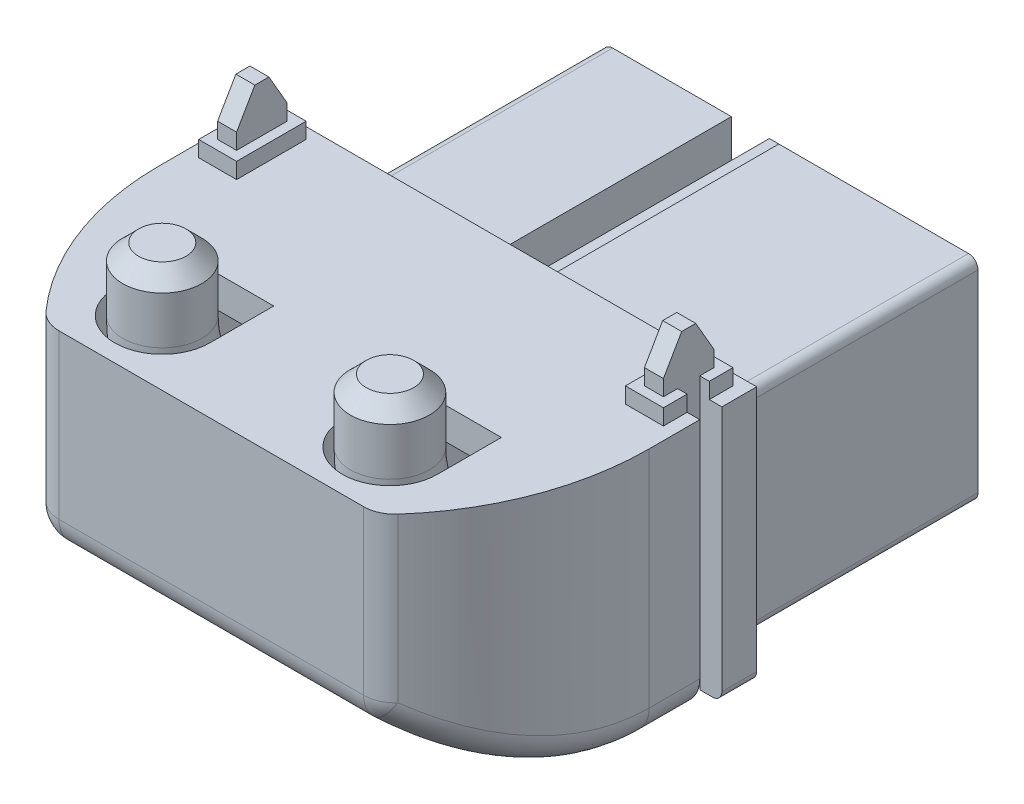
from build123d import *
from OCP.BRepFilletAPI import BRepFilletAPI_MakeChamfer

# Parameters (mm, degrees)
EXTRUDE_1_DEPTH                  = 11.1
CUT_EXTRUDE_1_DEPTH              = 7.7
SKETCH_13_R                      = 2.175
CUT_EXTRUDE_9_DEPTH              = 7.7
CUT_EXTRUDE_10_REACH             = 14.986
SKETCH_3_W                       = 1.5
SKETCH_3_H                       = 1.2
CUT_EXTRUDE_10_DIRECTION_2_REACH = 14.986
SKETCH_14_W                      = 1.5
SKETCH_14_H                      = 4
EXTRUDE_5_DEPTH                  = 1.2
EXTRUDE_START                    = 6.5
SKETCH_5_R                       = 2.175
EXTRUDE_3_DEPTH                  = 6.5
SKETCH_10_R                      = 2.15
CUT_EXTRUDE_7_DEPTH              = 6.5
SKETCH_16_R                      = 1.25
SKETCH_18_R                      = 1.25
EXTRUDE_7_DEPTH                  = 2
EXTRUDE_8_DEPTH                  = 8.1
EXTRUDE_START_2                  = -2.1
EXTRUDE_9_DEPTH                  = 2.1
SKETCH_21_W                      = 10.2
SKETCH_21_H                      = 2.025
EXTRUDE_12_DEPTH                 = 1
SKETCH_22_W                      = 0.6
SKETCH_22_H                      = 1.6
CUT_EXTRUDE_12_DEPTH             = 21.530769591
SKETCH_23_W                      = 0.7
SKETCH_23_H                      = 0.7
CUT_EXTRUDE_13_DEPTH             = 21.530769591
EXTRUDE_13_DEPTH                 = 2
EXTRUDE_13_DEPTH_BACK            = 7.6
SKETCH_24_W                      = 0.6
SKETCH_24_H                      = 1.6
EXTRUDE_14_DEPTH                 = 0.5
CHAMFER_2_SIZE                   = 1
CHAMFER_2_SIZE2                  = 0.577350269
CHAMFER_3_SIZE                   = 0.5
SKETCH_26_W                      = 9.9
SKETCH_26_H                      = 1.6
CUT_EXTRUDE_14_DEPTH             = 0.7
FILLET_4_R                       = 0.3
CUT_EXTRUDE_15_DEPTH             = 20.811738944
CUT_EXTRUDE_15_DEPTH_BACK        = 20.811738944
FILLET_5_R                       = 1


with BuildPart() as part:
    # Эскиз1 → Бобышка-Вытянуть1 (new body)
    with BuildSketch(Plane.XY):
        Polygon((-7.75, 1.221572875), (-7.75, -1.221572875), (-4.921572875, -4.05), (7.75, -4.05), (7.75, 4.05), (-4.921572875, 4.05), align=None)
    extrude(amount=EXTRUDE_1_DEPTH)

    # Эскиз2 → Вырез-Вытянуть1 (cut)
    with BuildSketch(Plane(origin=(0, 0, 0), x_dir=(-1, 0, 0), z_dir=(0, 0, -1))):
        Polygon((-7.75, 4.05), (-7.75, -4.05), (4.921572875, -4.05), (7.75, -1.221572875), (7.75, 1.221572875), (4.921572875, 4.05), align=None)
        Polygon((4.631623382, 3.35), (7.05, 0.931623382), (7.05, -0.931623382), (4.631623382, -3.35), (-7.05, -3.35), (-7.05, 3.35), align=None, mode=Mode.SUBTRACT)
    extrude(amount=-CUT_EXTRUDE_1_DEPTH, mode=Mode.SUBTRACT)

    # Эскиз13 → Вырез-Вытянуть9 (cut)
    with BuildSketch(Plane(origin=(0, 0, 0), x_dir=(-1, 0, 0), z_dir=(0, 0, -1))):
        with Locations((-3.6, 0)):
            Circle(SKETCH_13_R)
        with Locations((3.6, 0)):
            Circle(SKETCH_13_R)
    extrude(amount=-CUT_EXTRUDE_9_DEPTH, mode=Mode.SUBTRACT)

    # Вырез-Вытянуть10: up to this face of the body (flat: up to its plane)
    cut_extrude_10_end = Plane(part.part.faces().sort_by_distance((-3.6, 0, 7.7))[0])
    # Эскиз3 → Вырез-Вытянуть10 (cut, up to the picked face)
    with BuildSketch(Plane(origin=(0, 0, 1.5), x_dir=(-1, 0, 0), z_dir=(0, 0, -1)), mode=Mode.PRIVATE) as cut_extrude_10_sk1:
        with Locations((0, 2.75)):
            Rectangle(SKETCH_3_W, SKETCH_3_H)
    cut_extrude_10_tool1 = split(extrude(cut_extrude_10_sk1.sketch, amount=-CUT_EXTRUDE_10_REACH, mode=Mode.PRIVATE), bisect_by=cut_extrude_10_end, keep=Keep.BOTH, mode=Mode.PRIVATE)
    add(cut_extrude_10_tool1.solids().sort_by(Axis((0, 2.75, 1.5), (0, 0, 1)))[0], mode=Mode.SUBTRACT)

    # Вырез-Вытянуть10 direction 2: up to this face of the body (flat: up to its plane)
    cut_extrude_10_direction_2_end = Plane(part.part.faces().sort_by_distance((0.620013342, 0, 0))[0])
    # Эскиз3 → Вырез-Вытянуть10 direction 2 (cut, up to the picked face)
    with BuildSketch(Plane(origin=(0, 0, 1.5), x_dir=(-1, 0, 0), z_dir=(0, 0, -1)), mode=Mode.PRIVATE) as cut_extrude_10_direction_2_sk1:
        with Locations((0, 2.75)):
            Rectangle(SKETCH_3_W, SKETCH_3_H)
    cut_extrude_10_direction_2_tool1 = split(extrude(cut_extrude_10_direction_2_sk1.sketch, amount=CUT_EXTRUDE_10_DIRECTION_2_REACH, mode=Mode.PRIVATE), bisect_by=cut_extrude_10_direction_2_end, keep=Keep.BOTH, mode=Mode.PRIVATE)
    add(cut_extrude_10_direction_2_tool1.solids().sort_by(Axis((0, 2.75, 1.5), (0, 0, -1)))[0], mode=Mode.SUBTRACT)

    # Эскиз14 → Бобышка-Вытянуть5 (add)
    with BuildSketch(Plane(origin=(0, 0, 0), x_dir=(-1, 0, 0), z_dir=(0, 0, -1))):
        with Locations((0, 0.15)):
            Rectangle(SKETCH_14_W, SKETCH_14_H)
    extrude(amount=EXTRUDE_5_DEPTH)

    # Эскиз5 → Бобышка-Вытянуть3 (add)
    with BuildSketch(Plane(origin=(0, 0, 7.7), x_dir=(-1, 0, 0), z_dir=(0, 0, -1)).offset(EXTRUDE_START)):
        with Locations((3.6, 0)):
            Circle(SKETCH_5_R)
        with Locations((-3.6, 0)):
            Circle(SKETCH_5_R)
    extrude(amount=-EXTRUDE_3_DEPTH)

    # Эскиз10 → Вырез-Вытянуть7 (cut)
    with BuildSketch(Plane(origin=(0, 0, 1.2), x_dir=(-1, 0, 0), z_dir=(0, 0, -1))):
        with Locations((-3.6, 0)):
            Circle(SKETCH_10_R)
        with Locations((3.6, 0)):
            Circle(SKETCH_10_R)
    extrude(amount=-CUT_EXTRUDE_7_DEPTH, mode=Mode.SUBTRACT)

    # По траектории1: sweep along a path in Эскиз17
    with BuildLine(Plane(origin=(0, 0, 0), x_dir=(0, 0, -1), z_dir=(1, 0, 0))) as sweep_1_path:
        ThreePointArc((-15.15, 4.05), (-13.963782464, 1.186217536), (-11.1, 0))
    # Эскиз16 → По траектории1 (sweep)
    with BuildSketch(Plane.XY.offset(11.1)):
        with Locations((3.6, 0)):
            Circle(SKETCH_16_R)
        with Locations((-3.6, 0)):
            Circle(SKETCH_16_R)
    sweep(path=sweep_1_path.line)

    # Эскиз18 → Бобышка-Вытянуть7 (add)
    with BuildSketch(Plane(origin=(0, 4.05, 0), x_dir=(1, 0, 0), z_dir=(0, 1, 0))):
        with Locations(Location((3.6, -15.15, 0), (0, 0, 270))):
            Circle(SKETCH_18_R)
        with Locations(Location((-3.6, -15.15, 0), (0, 0, 270))):
            Circle(SKETCH_18_R)
    extrude(amount=EXTRUDE_7_DEPTH)

    # Эскиз19 → Бобышка-Вытянуть8 (add)
    with BuildSketch(Plane(origin=(0, 4.05, 0), x_dir=(1, 0, 0), z_dir=(0, 1, 0))):
        with BuildLine():
            ThreePointArc((5.25, -17.2), (7.100752265, -14.396209945), (7.75, -11.1))
            Line((7.75, -11.1), (5.1, -11.1))
            Line((5.1, -11.1), (5.1, -15.15))
            ThreePointArc((5.1, -15.15), (3.6, -16.65), (2.1, -15.15))
            Line((2.1, -15.15), (2.1, -11.1))
            Line((2.1, -11.1), (-2.1, -11.1))
            Line((-2.1, -11.1), (-2.1, -15.15))
            ThreePointArc((-2.1, -15.15), (-3.6, -16.65), (-5.1, -15.15))
            Line((-5.1, -15.15), (-5.1, -11.1))
            Line((-5.1, -11.1), (-4.921572875, -11.1))
            Line((-4.921572875, -11.1), (-4.921572875, -7.7))
            Line((-4.921572875, -7.7), (-7.75, -7.7))
            Line((-7.75, -7.7), (-7.75, -11.1))
            ThreePointArc((-7.75, -11.1), (-7.100752265, -14.396209945), (-5.25, -17.2))
            Line((-5.25, -17.2), (5.25, -17.2))
        make_face()
    extrude(amount=-EXTRUDE_8_DEPTH)

    # Эскиз20 → Бобышка-Вытянуть9 (add)
    with BuildSketch(Plane.XZ.offset(4.05).offset(EXTRUDE_START_2)):
        with BuildLine():
            Line((-7.75, 7.7), (7.75, 7.7))
            Line((7.75, 7.7), (7.75, 11.1))
            ThreePointArc((7.75, 11.1), (7.100752265, 14.396209945), (5.25, 17.2))
            Line((5.25, 17.2), (-5.25, 17.2))
            ThreePointArc((-5.25, 17.2), (-7.100752265, 14.396209945), (-7.75, 11.1))
            Line((-7.75, 11.1), (-7.75, 7.7))
        make_face()
    extrude(amount=EXTRUDE_9_DEPTH)

    # Эскиз21 → Бобышка-Вытянуть12 (add)
    with BuildSketch(Plane(origin=(0, 4.05, 0), x_dir=(1, 0, 0), z_dir=(0, 1, 0))):
        with Locations((0, -12.1125)):
            Rectangle(SKETCH_21_W, SKETCH_21_H)
    extrude(amount=-EXTRUDE_12_DEPTH)

    # Эскиз22 → Вырез-Вытянуть12 (cut, through all)
    with BuildSketch(Plane(origin=(0, 4.05, 0), x_dir=(1, 0, 0), z_dir=(0, 1, 0))):
        with Locations((-6.75, -9.15)):
            Rectangle(SKETCH_22_W, SKETCH_22_H)
        with Locations((6.75, -9.15)):
            Rectangle(SKETCH_22_W, SKETCH_22_H)
    extrude(amount=-CUT_EXTRUDE_12_DEPTH, mode=Mode.SUBTRACT)

    # Эскиз23 → Вырез-Вытянуть13 (cut, through all)
    with BuildSketch(Plane(origin=(0, 4.05, 0), x_dir=(1, 0, 0), z_dir=(0, 1, 0))):
        with Locations((-7.4, -9.15)):
            Rectangle(SKETCH_23_W, SKETCH_23_H)
        with Locations((7.4, -9.15)):
            Rectangle(SKETCH_23_W, SKETCH_23_H)
    extrude(amount=-CUT_EXTRUDE_13_DEPTH, mode=Mode.SUBTRACT)

    # Эскиз24 → Бобышка-Вытянуть13 (add, two sides: drawn at the far end of the back side and taken through both)
    with BuildSketch(Plane(origin=(0, 4.05, 0), x_dir=(1, 0, 0), z_dir=(0, 1, 0)).offset(-EXTRUDE_13_DEPTH_BACK)):
        with Locations((-6.75, -9.15)):
            Rectangle(SKETCH_24_W, SKETCH_24_H)
        with Locations((6.75, -9.15)):
            Rectangle(SKETCH_24_W, SKETCH_24_H)
    extrude(amount=EXTRUDE_13_DEPTH + EXTRUDE_13_DEPTH_BACK)

    # Эскиз25 → Бобышка-Вытянуть14 (add)
    with BuildSketch(Plane(origin=(0, 4.05, 0), x_dir=(1, 0, 0), z_dir=(0, 1, 0))):
        Polygon((-6.15, -8.05), (-7.35, -8.05), (-7.35, -8.8), (-7.05, -8.8), (-7.05, -8.35), (-6.45, -8.35), (-6.45, -9.95), (-7.05, -9.95), (-7.05, -9.5), (-7.35, -9.5), (-7.35, -10.25), (-6.15, -10.25), align=None)
        Polygon((7.35, -8.05), (6.15, -8.05), (6.15, -10.25), (7.35, -10.25), (7.35, -9.5), (7.05, -9.5), (7.05, -9.95), (6.45, -9.95), (6.45, -8.35), (7.05, -8.35), (7.05, -8.8), (7.35, -8.8), align=None)
    extrude(amount=EXTRUDE_14_DEPTH)

    # Фаска2: one chamfer whose edges measure the first distance from different faces: ONE call of the kernel's chamfer builder (chamfer() names one face for all edges)
    chamfer_2_edges_1 = [part.edges().sort_by_distance(p)[0] for p in [
        (-6.75, 6.05, 9.95),
    ]]
    chamfer_2_side_1 = [part.faces().sort_by_distance(p)[0] for p in [
        (-6.75, 5.3, 9.95),
    ]]
    chamfer_2_edges_2 = [part.edges().sort_by_distance(p)[0] for p in [
        (-6.75, 6.05, 8.35),
    ]]
    chamfer_2_side_2 = [part.faces().sort_by_distance(p)[0] for p in [
        (-6.75, 5.3, 8.35),
    ]]
    chamfer_2_edges_3 = [part.edges().sort_by_distance(p)[0] for p in [
        (6.75, 6.05, 9.95),
    ]]
    chamfer_2_side_3 = [part.faces().sort_by_distance(p)[0] for p in [
        (6.75, 5.3, 9.95),
    ]]
    chamfer_2_edges_4 = [part.edges().sort_by_distance(p)[0] for p in [
        (6.75, 6.05, 8.35),
    ]]
    chamfer_2_side_4 = [part.faces().sort_by_distance(p)[0] for p in [
        (6.75, 5.3, 8.35),
    ]]
    chamfer_2 = BRepFilletAPI_MakeChamfer(part.part.solid().wrapped)
    for e in chamfer_2_edges_1:
        chamfer_2.Add(CHAMFER_2_SIZE, CHAMFER_2_SIZE2, e.wrapped, chamfer_2_side_1[0].wrapped)  # the first distance lies on this face
    for e in chamfer_2_edges_2:
        chamfer_2.Add(CHAMFER_2_SIZE, CHAMFER_2_SIZE2, e.wrapped, chamfer_2_side_2[0].wrapped)  # the first distance lies on this face
    for e in chamfer_2_edges_3:
        chamfer_2.Add(CHAMFER_2_SIZE, CHAMFER_2_SIZE2, e.wrapped, chamfer_2_side_3[0].wrapped)  # the first distance lies on this face
    for e in chamfer_2_edges_4:
        chamfer_2.Add(CHAMFER_2_SIZE, CHAMFER_2_SIZE2, e.wrapped, chamfer_2_side_4[0].wrapped)  # the first distance lies on this face
    add(Compound.cast(chamfer_2.Shape()), mode=Mode.REPLACE)

    # Фаска3
    chamfer_3_edges = [part.edges().sort_by_distance(p)[0] for p in [
        (3.6, 6.05, 13.9),
        (-3.6, 6.05, 13.9),
    ]]
    chamfer(chamfer_3_edges, length=CHAMFER_3_SIZE)

    # Эскиз26 → Вырез-Вытянуть14 (cut)
    with BuildSketch(Plane.XZ.offset(4.05)):
        with Locations((0, 9.15)):
            Rectangle(SKETCH_26_W, SKETCH_26_H)
    extrude(amount=-CUT_EXTRUDE_14_DEPTH, mode=Mode.SUBTRACT)

    # Скругление4
    fillet_4_edges = [part.edges().sort_by_distance(p)[0] for p in [
        (7.75, -4.05, 8.25),
        (-7.75, -4.05, 8.25),
        (7.05, 3.35, 3.85),
        (7.05, -3.35, 3.85),
        (-4.631623382, -3.35, 3.85),
        (-7.05, -0.931623382, 3.85),
        (-7.05, 0.931623382, 3.85),
        (-4.631623382, 3.35, 3.85),
        (4.95, -3.7, 9.95),
        (4.95, -3.7, 8.35),
        (-4.95, -3.7, 8.35),
        (-4.95, -3.7, 9.95),
    ]]
    fillet(fillet_4_edges, radius=FILLET_4_R)

    # Эскиз27 → Вырез-Вытянуть15 (cut, two sides: drawn at the far end of the back side and taken through both)
    with BuildSketch(Plane(origin=(0, 0, 0), x_dir=(0, 0, -1), z_dir=(1, 0, 0)).offset(-CUT_EXTRUDE_15_DEPTH_BACK)):
        with BuildLine():
            Line((-11.1, -4.05), (-17.2, -4.05))
            Line((-17.2, -4.05), (-17.2, -1.55))
            ThreePointArc((-17.2, -1.55), (-14.396209945, -3.400752265), (-11.1, -4.05))
        make_face()
    extrude(amount=CUT_EXTRUDE_15_DEPTH + CUT_EXTRUDE_15_DEPTH_BACK, mode=Mode.SUBTRACT)

    # Скругление5
    fillet_5_edges = [part.edges().sort_by_distance(p)[0] for p in [
        (7.75, -4.05, 10.3),
        (-7.75, -4.05, 10.3),
        (5.25, 1.25, 17.2),
        (-5.25, 1.25, 17.2),
        (7.027776856, -3.327776856, 14.568936562),
        (-7.027776856, -3.327776856, 14.568936562),
        (0, -1.55, 17.2),
    ]]
    fillet(fillet_5_edges, radius=FILLET_5_R)


solid = part.part
